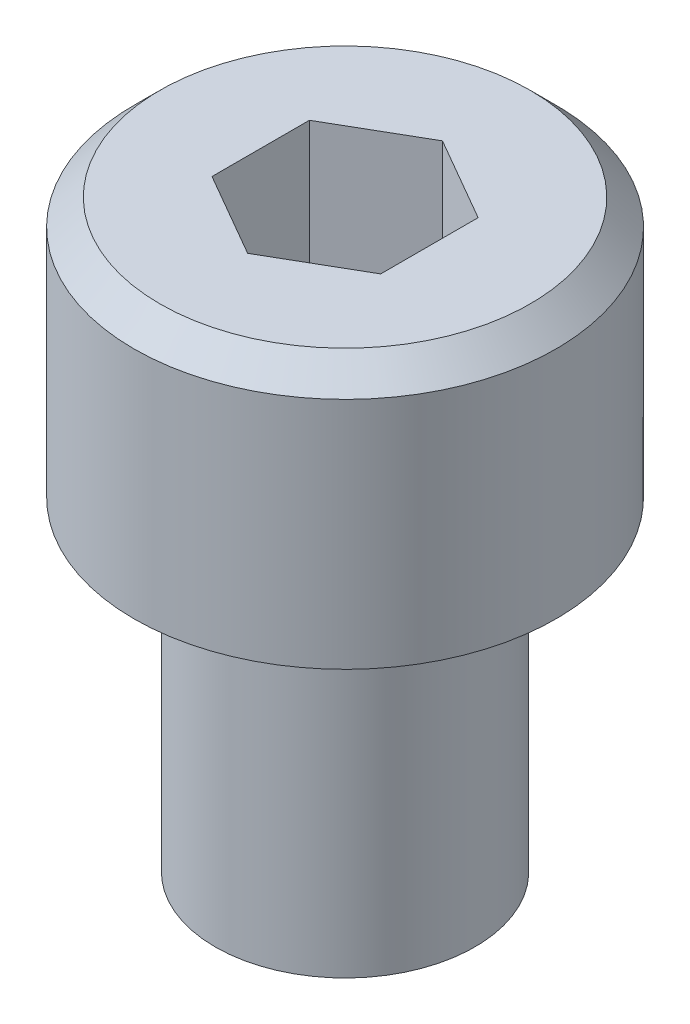
from build123d import *

# Parameters (mm, degrees)
CROQUIS4_R              = 6.5
SALIENTE_EXTRUIR3_DEPTH = 8
CHAFL_N2_SIZE           = 0.8
CROQUIS6_5_R            = 4
SALIENTE_EXTRUIR7_DEPTH = 10


with BuildPart() as part:
    # Croquis4 → Saliente-Extruir3 (new body)
    with BuildSketch(Plane(origin=(0, 0, 0), x_dir=(1, 0, 0), z_dir=(0, 1, 0))):
        Circle(CROQUIS4_R)
        Polygon((0, 3), (-2.598076211, 1.5), (-2.598076211, -1.5), (0, -3), (2.598076211, -1.5), (2.598076211, 1.5), align=None, mode=Mode.SUBTRACT)
    extrude(amount=SALIENTE_EXTRUIR3_DEPTH)

    # Chaflán2
    chafl_n2_edges = [part.edges().sort_by_distance(p)[0] for p in [
        (-6.5, 8, 0),
    ]]
    chamfer(chafl_n2_edges, length=CHAFL_N2_SIZE)

    # Croquis5 → Revolución2 (revolve)
    with BuildSketch(Plane.XY):
        Polygon((0, 0), (0, 2.267949192), (3, 4), (6.5, 4), (6.5, 0), align=None)
    revolve(axis=Axis((0, 0, 0), (0, 1, 0)))

    # Croquis6<5> → Saliente-Extruir7 (add)
    with BuildSketch(Plane.XZ):
        Circle(CROQUIS6_5_R)
    extrude(amount=SALIENTE_EXTRUIR7_DEPTH)


solid = part.part
